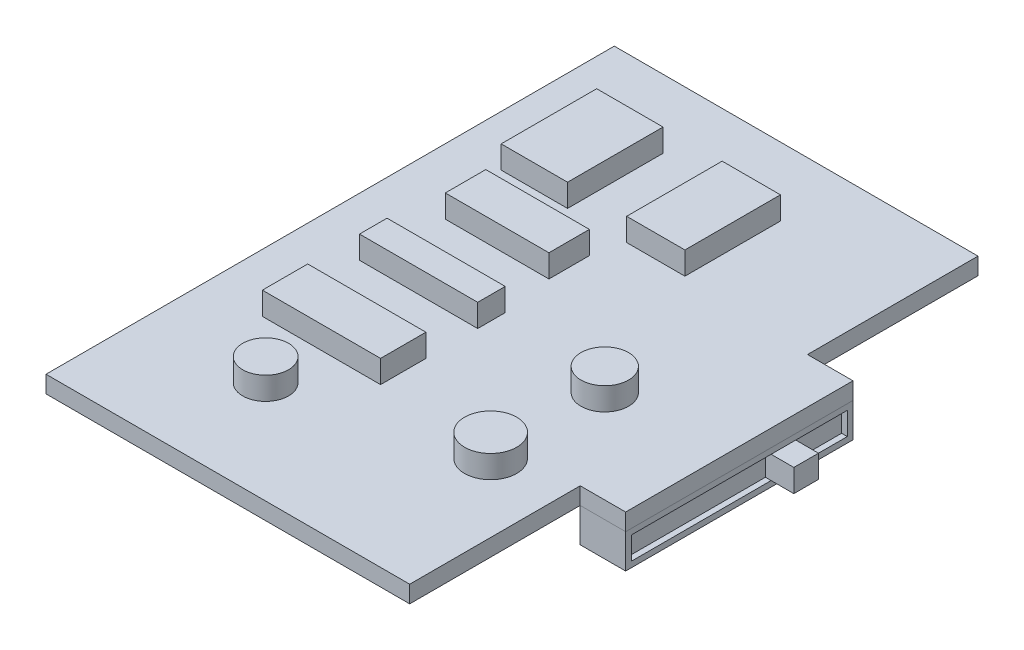
from build123d import *

# Parameters (mm, degrees)
BOSS_EXTRUDE1_DEPTH = 0.75
SKETCH1_3_W         = 2
SKETCH1_3_H         = 10
BOSS_EXTRUDE2_DEPTH = 1.5
SKETCH3_W           = 9.5
SKETCH3_H           = 1
CUT_EXTRUDE1_DEPTH  = 0.25
SKETCH5_W           = 1.083860034
SKETCH5_H           = 1
BOSS_EXTRUDE3_DEPTH = 1.25
SKETCH6_R           = 1.047284205
SKETCH6_R_2         = 1.146689612
SKETCH6_R_3         = 1.007796297
SKETCH6_W           = 2.919915963
SKETCH6_H           = 4.201830289
SKETCH6_W_2         = 2.563828651
SKETCH6_W_3         = 4.557917602
SKETCH6_H_2         = 1.780436563
SKETCH6_W_4         = 5.198874764
SKETCH6_H_3         = 1.210696863
SKETCH6_H_4         = 1.994088951
BOSS_EXTRUDE4_DEPTH = 1


with BuildPart() as part:
    # Sketch1 → Boss-Extrude1 (new body)
    with BuildSketch(Plane(origin=(0, 0, 0), x_dir=(1, 0, 0), z_dir=(0, 1, 0))):
        Polygon((8, 12.5), (-8, 12.5), (-8, -12.5), (8, -12.5), (8, -5), (10, -5), (10, 5), (8, 5), align=None)
    extrude(amount=BOSS_EXTRUDE1_DEPTH)

    # Sketch6 → Boss-Extrude4 (add)
    with BuildSketch(Plane(origin=(0, 0.75, 0), x_dir=(1, 0, 0), z_dir=(0, 1, 0))):
        with Locations((4.989655664, -0.908022647)):
            Circle(SKETCH6_R)
        with Locations((4.989655664, -5.928853755)):
            Circle(SKETCH6_R_2)
        with Locations((-2.844265214, -7.994160168)):
            Circle(SKETCH6_R_3)
        with Locations((-4.304223196, 7.388811737)):
            Rectangle(SKETCH6_W, SKETCH6_H)
        with Locations((1.037086494, 7.388811737)):
            Rectangle(SKETCH6_W_2, SKETCH6_H)
        with Locations((-2.844265214, 3.080155255)):
            Rectangle(SKETCH6_W_3, SKETCH6_H_2)
        with Locations((-2.844265214, -0.658761529)):
            Rectangle(SKETCH6_W_4, SKETCH6_H_3)
        with Locations((-2.844265214, -4.540113236)):
            Rectangle(SKETCH6_W_4, SKETCH6_H_4)
    extrude(amount=BOSS_EXTRUDE4_DEPTH)


with BuildPart() as body_2:
    # Sketch1<3> → Boss-Extrude2 (new body)
    with BuildSketch(Plane(origin=(0, 0, 0), x_dir=(1, 0, 0), z_dir=(0, 1, 0))):
        with Locations((9, 0)):
            Rectangle(SKETCH1_3_W, SKETCH1_3_H)
    extrude(amount=-BOSS_EXTRUDE2_DEPTH)

    # Sketch3 → Cut-Extrude1 (cut)
    with BuildSketch(Plane(origin=(10, 0, 0), x_dir=(0, 0, -1), z_dir=(1, 0, 0))):
        with Locations((0, -0.75)):
            Rectangle(SKETCH3_W, SKETCH3_H)
    extrude(amount=-CUT_EXTRUDE1_DEPTH, mode=Mode.SUBTRACT)

    # Sketch5 → Boss-Extrude3 (add)
    with BuildSketch(Plane(origin=(9.75, 0, 0), x_dir=(0, 0, -1), z_dir=(1, 0, 0))):
        with Locations((1.940310185, -0.75)):
            Rectangle(SKETCH5_W, SKETCH5_H)
    extrude(amount=BOSS_EXTRUDE3_DEPTH)


solid = Compound([part.part, body_2.part])
